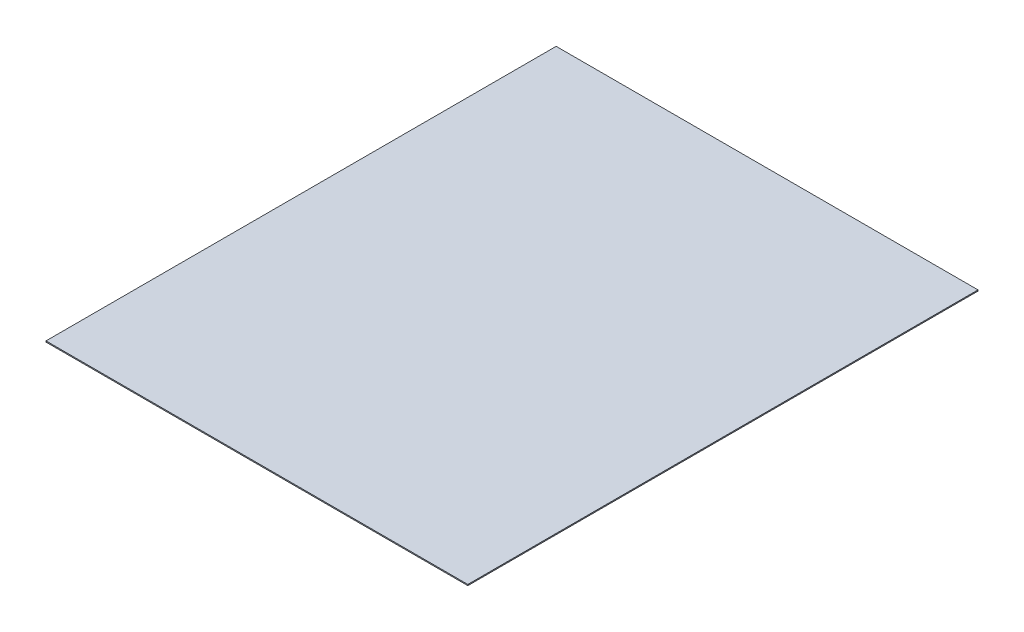
from build123d import *

# Parameters (mm, degrees)
CEK_ICECEK_TEPSI_TABAN_SACI_1_5_1_START = -3
SKETCH1_W                               = 584.6
SKETCH1_H                               = 1.5
CEK_ICECEK_TEPSI_TABAN_SACI_1_5_1_DEPTH = 707


with BuildPart() as part:
    # Sketch1 → CEK_icecek_tepsi_taban_saci_1.5_1 (new body)
    with BuildSketch(Plane.XY.offset(CEK_ICECEK_TEPSI_TABAN_SACI_1_5_1_START)):
        with Locations((309, 5.75)):
            Rectangle(SKETCH1_W, SKETCH1_H)
    extrude(amount=-CEK_ICECEK_TEPSI_TABAN_SACI_1_5_1_DEPTH)


solid = part.part
